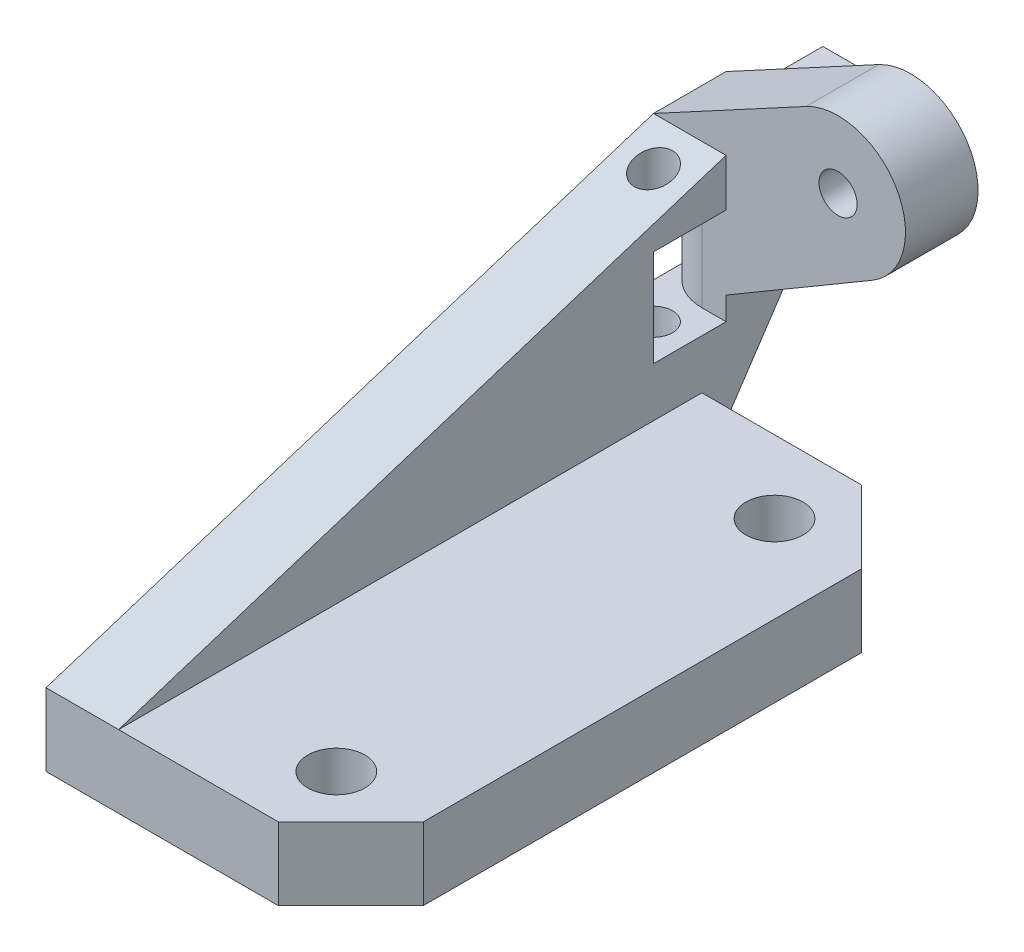
from build123d import *

# Parameters (mm, degrees)
SKETCH1_W                    = 12.192
SKETCH1_H                    = 30.62
SKETCH1_R                    = 1.5
BOSS_EXTRUDE1_DEPTH          = 3.81
BOSS_EXTRUDE2_DEPTH          = 3.81
SKETCH3_W                    = 1.778
SKETCH3_H                    = 1.778
BOSS_EXTRUDE3_DEPTH          = 5.08
SKETCH4_R                    = 1
BOSS_EXTRUDE4_DEPTH          = 3.81
CUT_EXTRUDE1_REACH           = 49.638
SKETCH5_W                    = 3.81
SKETCH5_H                    = 5.08
SKETCH6_R                    = 1
CUT_EXTRUDE2_DEPTH           = 45.307989371
CUT_EXTRUDE2_OTHER_WAY_DEPTH = 5.08
CUT_EXTRUDE2_OTHER_WAY_TAPER = 5
CHAMFER1_SIZE                = 0.762
FILLET1_R                    = 2.54
CHAMFER2_SIZE                = 3.81
FILLET2_R                    = 0.762


with BuildPart() as part:
    # Sketch1 → Boss-Extrude1 (new body)
    with BuildSketch(Plane(origin=(0, 0, 0), x_dir=(1, 0, 0), z_dir=(0, 1, 0))):
        with Locations((6.096, 15.31)):
            Rectangle(SKETCH1_W, SKETCH1_H)
        with Locations(Location((7.62, 26.81, 0), (0, 0, 90))):
            Circle(SKETCH1_R, mode=Mode.SUBTRACT)
        with Locations(Location((7.62, 3.81, 0), (0, 0, 90))):
            Circle(SKETCH1_R, mode=Mode.SUBTRACT)
    extrude(amount=BOSS_EXTRUDE1_DEPTH)

    # Sketch2 → Boss-Extrude2 (add)
    with BuildSketch(Plane.ZY):
        Polygon((0, 3.81), (0, 0), (-30.62, 0), (-35.7, 7.62), (-35.7, 13.97), (-31.89, 13.97), align=None)
    extrude(amount=BOSS_EXTRUDE2_DEPTH)

    # Sketch3 → Boss-Extrude3 (add)
    with BuildSketch(Plane(origin=(0, 0, -35.7), x_dir=(-1, 0, 0), z_dir=(0, 0, -1))):
        with Locations((2.921, 8.509)):
            Rectangle(SKETCH3_W, SKETCH3_H)
        with Locations((2.921, 11.684)):
            Rectangle(SKETCH3_W, SKETCH3_H)
    extrude(amount=BOSS_EXTRUDE3_DEPTH)

    # Sketch4 → Boss-Extrude4 (add)
    with BuildSketch(Plane(origin=(0, 0, -35.7), x_dir=(-1, 0, 0), z_dir=(0, 0, -1))):
        with BuildLine():
            Line((0, 7.62), (-7.670279519, 12.123848354))
            ThreePointArc((-7.670279519, 12.123848354), (-8.962218829, 16.913759957), (-4.196321779, 18.2916517))
            Line((-4.196321779, 18.2916517), (3.81, 13.97))
            Line((3.81, 13.97), (0, 13.97))
            Line((0, 13.97), (0, 7.62))
        make_face()
        with Locations((-5.877818102, 15.1765)):
            Circle(SKETCH4_R, mode=Mode.SUBTRACT)
    extrude(amount=-BOSS_EXTRUDE4_DEPTH)

    # Sketch5 → Cut-Extrude1 (cut, up to next)
    with BuildSketch(Plane.ZY.offset(3.81), mode=Mode.PRIVATE) as cut_extrude1_sk1:
        with Locations((-29.985, 8.946152399)):
            Rectangle(SKETCH5_W, SKETCH5_H)
    cut_extrude1_tool1 = extrude(cut_extrude1_sk1.sketch, amount=-CUT_EXTRUDE1_REACH, mode=Mode.PRIVATE) & part.part
    add(cut_extrude1_tool1.solids().sort_by_distance((-3.81, 8.946152, -29.985))[0], mode=Mode.SUBTRACT)

    # Sketch6 → Cut-Extrude2 (cut)
    with BuildSketch(Plane(origin=(0, 6.406152399, 0), x_dir=(1, 0, 0), z_dir=(0, 1, 0))):
        with Locations(Location((-1.905, 29.985, 0), (0, 0, 270))):
            Circle(SKETCH6_R)
    extrude(amount=CUT_EXTRUDE2_DEPTH, mode=Mode.SUBTRACT)

    # Sketch6 → Cut-Extrude2 other way (cut)
    with BuildSketch(Plane(origin=(0, 6.406152399, 0), x_dir=(1, 0, 0), z_dir=(0, 1, 0))):
        with Locations(Location((-1.905, 29.985, 0), (0, 0, 270))):
            Circle(SKETCH6_R)
    extrude(amount=-CUT_EXTRUDE2_OTHER_WAY_DEPTH, taper=CUT_EXTRUDE2_OTHER_WAY_TAPER, mode=Mode.SUBTRACT)

    # Chamfer1
    chamfer1_edges = [part.edges().sort_by_distance(p)[0] for p in [
        (-3.81, 9.398, -38.24),
        (-2.032, 9.398, -38.24),
        (-2.032, 10.795, -38.24),
    ]]
    chamfer(chamfer1_edges, length=CHAMFER1_SIZE)

    # Fillet1
    fillet1_edges = [part.edges().sort_by_distance(p)[0] for p in [
        (-3.81, 8.946152399, -31.89),
    ]]
    fillet(fillet1_edges, radius=FILLET1_R)

    # Chamfer2
    chamfer2_edges = [part.edges().sort_by_distance(p)[0] for p in [
        (12.192, 1.905, -30.62),
        (12.192, 1.905, 0),
    ]]
    chamfer(chamfer2_edges, length=CHAMFER2_SIZE)

    # Fillet2
    fillet2_edges = [part.edges().sort_by_distance(p)[0] for p in [
        (-3.81, 9.7155, -35.7),
    ]]
    fillet(fillet2_edges, radius=FILLET2_R)


solid = part.part
